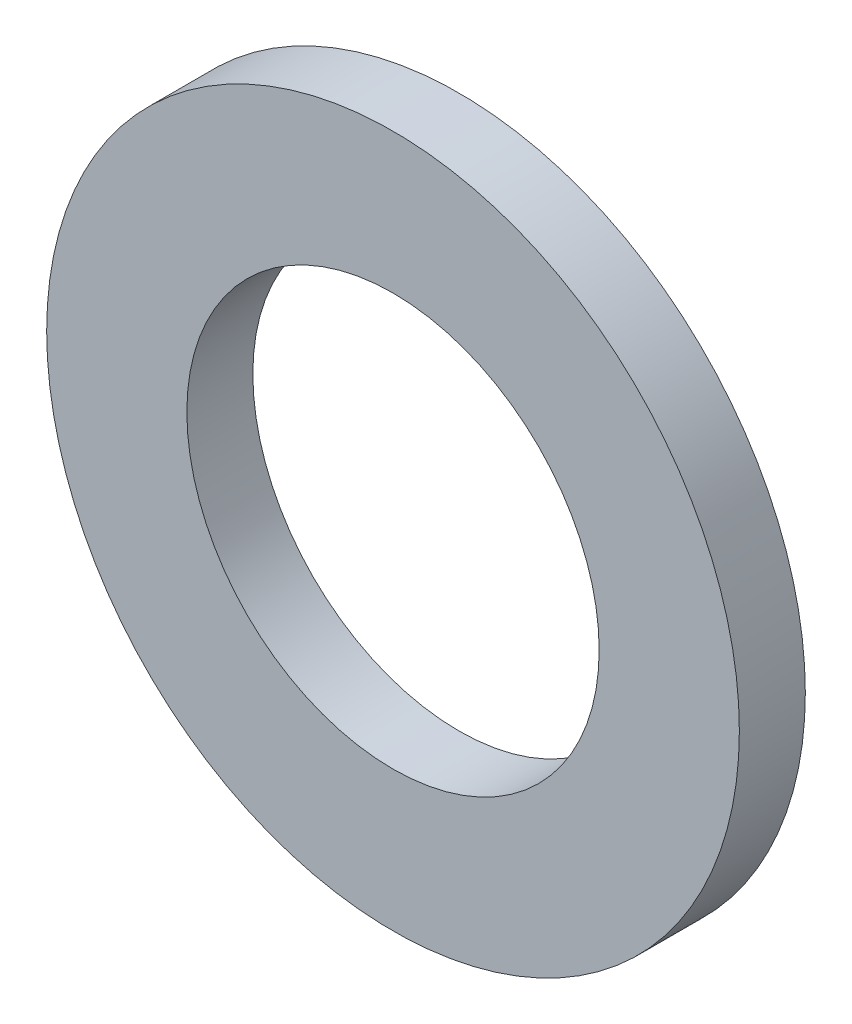
from build123d import *

# Parameters (mm, degrees)
SKETCH1_R           = 21
SKETCH1_R_2         = 12.5
BOSS_EXTRUDE1_DEPTH = 4


with BuildPart() as part:
    # Sketch1 → Boss-Extrude1 (new body)
    with BuildSketch(Plane.XY):
        Circle(SKETCH1_R)
        Circle(SKETCH1_R_2, mode=Mode.SUBTRACT)
    extrude(amount=BOSS_EXTRUDE1_DEPTH)


solid = part.part
